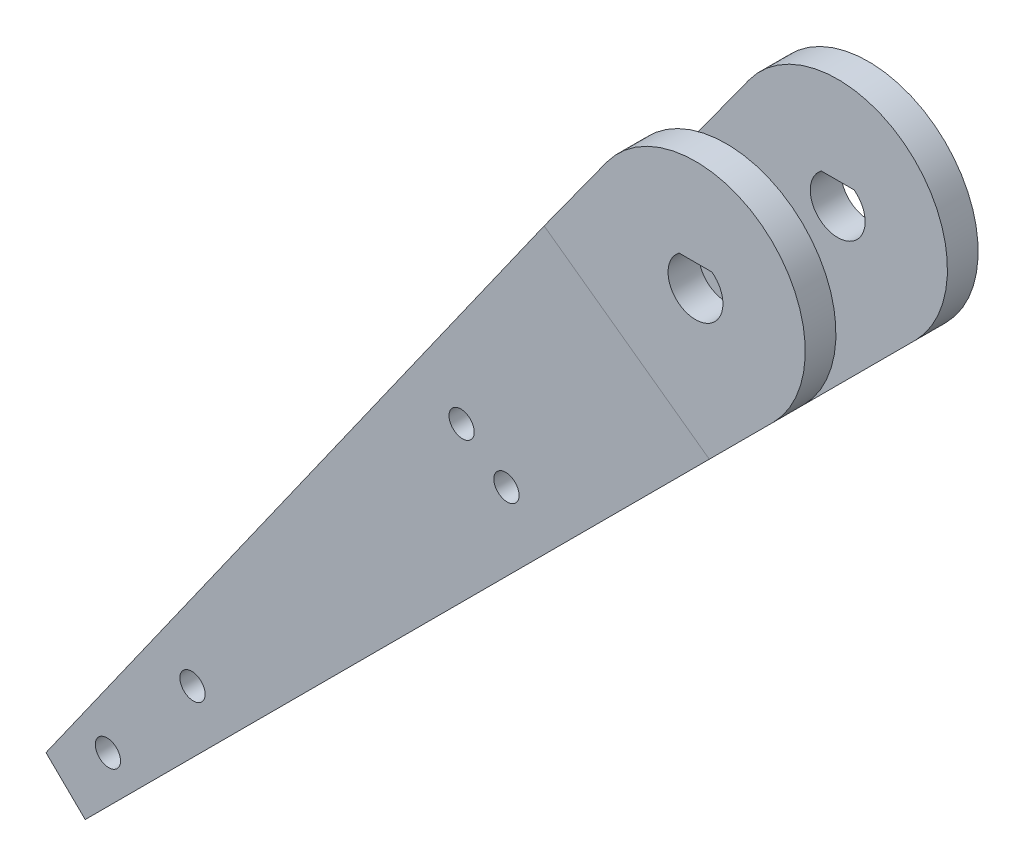
from build123d import *

# Parameters (mm, degrees)
BASE_VOLUME_DEPTH   = 10
WEIGHT_SAVING_REACH = 140.59
D_SHAFT_HOLE_REACH  = 140.062
TROUS_M3_DEPTH      = 139.273289153
TROUS_M3_DEPTH_BACK = 139.273289153
SKETCH15_R          = 1.5


with BuildPart() as part:
    # Sketch9 → base_volume (new body)
    with BuildSketch(Plane.XY):
        with BuildLine():
            Line((-2.24506403, 2.24506403), (2.24506403, -2.24506403))
            Line((2.24506403, -2.24506403), (86.830152477, 82.340024416))
            ThreePointArc((86.830152477, 82.340024416), (86.087387236, 100.986393717), (67.559180599, 98.762804922))
            Line((67.559180599, 98.762804922), (-2.24506403, 2.24506403))
        make_face()
    base_volume = extrude(amount=-BASE_VOLUME_DEPTH)

    # weight_saving: up to this plane
    weight_saving_end = Plane(origin=(2.24506403, -2.24506403, -10), z_dir=(0.7071067811865464, -0.7071067811865487, 0))
    # Sketch10 → weight_saving (cut, up to the surface)
    with BuildSketch(Plane(origin=(-2.540124292, 1.837086693, 0), x_dir=(0, 0, 1), z_dir=(-0.8102925792823216, 0.5860255420713356, 0)), mode=Mode.PRIVATE) as weight_saving_sk1:
        Polygon((-5, -0.503493858), (-10, 107.3), (-10, -0.503493858), align=None)
    weight_saving_tool1 = split(extrude(weight_saving_sk1.sketch, amount=-WEIGHT_SAVING_REACH, mode=Mode.PRIVATE), bisect_by=weight_saving_end, keep=Keep.BOTH, mode=Mode.PRIVATE)
    # Sketch10 → weight_saving (cut, up to the surface)
    with BuildSketch(Plane(origin=(-2.540124292, 1.837086693, 0), x_dir=(0, 0, 1), z_dir=(-0.8102925792823216, 0.5860255420713356, 0)), mode=Mode.PRIVATE) as weight_saving_sk2:
        Polygon((0, 83), (0, 132.318173369), (-6.45, 132.318173369), (-6.45, 92.318173369), (-5.949148181, 83), align=None)
    weight_saving_tool2 = split(extrude(weight_saving_sk2.sketch, amount=-WEIGHT_SAVING_REACH, mode=Mode.PRIVATE), bisect_by=weight_saving_end, keep=Keep.BOTH, mode=Mode.PRIVATE)
    # Sketch10 → weight_saving (cut, up to the surface)
    with BuildSketch(Plane(origin=(-2.540124292, 1.837086693, 0), x_dir=(0, 0, 1), z_dir=(-0.8102925792823216, 0.5860255420713356, 0)), mode=Mode.PRIVATE) as weight_saving_sk3:
        Polygon((0, 32.318173369), (0, 77), (-5.626648181, 77), (-3.225, 32.318173369), align=None)
    weight_saving_tool3 = split(extrude(weight_saving_sk3.sketch, amount=-WEIGHT_SAVING_REACH, mode=Mode.PRIVATE), bisect_by=weight_saving_end, keep=Keep.BOTH, mode=Mode.PRIVATE)
    weight_saving = weight_saving_tool1.solids().sort_by_distance((18.223349, 30.546566, -8.333333))[0] + weight_saving_tool2.solids().sort_by_distance((60.64419, 89.201506, -3.202401))[0] + weight_saving_tool3.solids().sort_by_distance((30.675578, 47.764158, -2.267214))[0]
    add(weight_saving, mode=Mode.SUBTRACT)

    # Sketch11 → D-shaft_hole (cut, up to next)
    with BuildSketch(Plane.XY.offset(-6.45), mode=Mode.PRIVATE) as d_shaft_hole_sk1:
        with BuildLine():
            Line((75.954896356, 93.86774987), (79.744896356, 93.86774987))
            ThreePointArc((79.744896356, 93.86774987), (77.849896356, 88.145280537), (75.954896356, 93.86774987))
        make_face()
    d_shaft_hole_tool1 = extrude(d_shaft_hole_sk1.sketch, amount=-D_SHAFT_HOLE_REACH, mode=Mode.PRIVATE) & part.part
    d_shaft_hole = d_shaft_hole_tool1.solids().sort_by_distance((77.849896, 91.169307, -6.45))[0]
    add(d_shaft_hole, mode=Mode.SUBTRACT)

    # Mirror1: base_volume, weight_saving, D-shaft_hole across plane
    add(base_volume.mirror(Plane.XY))
    add(weight_saving.mirror(Plane.XY), mode=Mode.SUBTRACT)
    add(d_shaft_hole.mirror(Plane.XY), mode=Mode.SUBTRACT)

    # Sketch15 → trous_m3 (cut, two sides: drawn at the far end of the back side and taken through both)
    with BuildSketch(Plane.XY.offset(-TROUS_M3_DEPTH_BACK)):
        with Locations(Location((5.268760152, 6.160633141, 0), (0, 0, 54.124527059))):
            Circle(SKETCH15_R)
        with Locations(Location((15.806280456, 18.481899424, 0), (0, 0, 54.124527059))):
            Circle(SKETCH15_R)
        with Locations(Location((49.527674377, 62.910014332, 0), (0, 0, 54.124527059))):
            Circle(SKETCH15_R)
        with Locations(Location((54.713429681, 59.159535628, 0), (0, 0, 54.124527059))):
            Circle(SKETCH15_R)
    extrude(amount=TROUS_M3_DEPTH + TROUS_M3_DEPTH_BACK, mode=Mode.SUBTRACT)


solid = part.part
